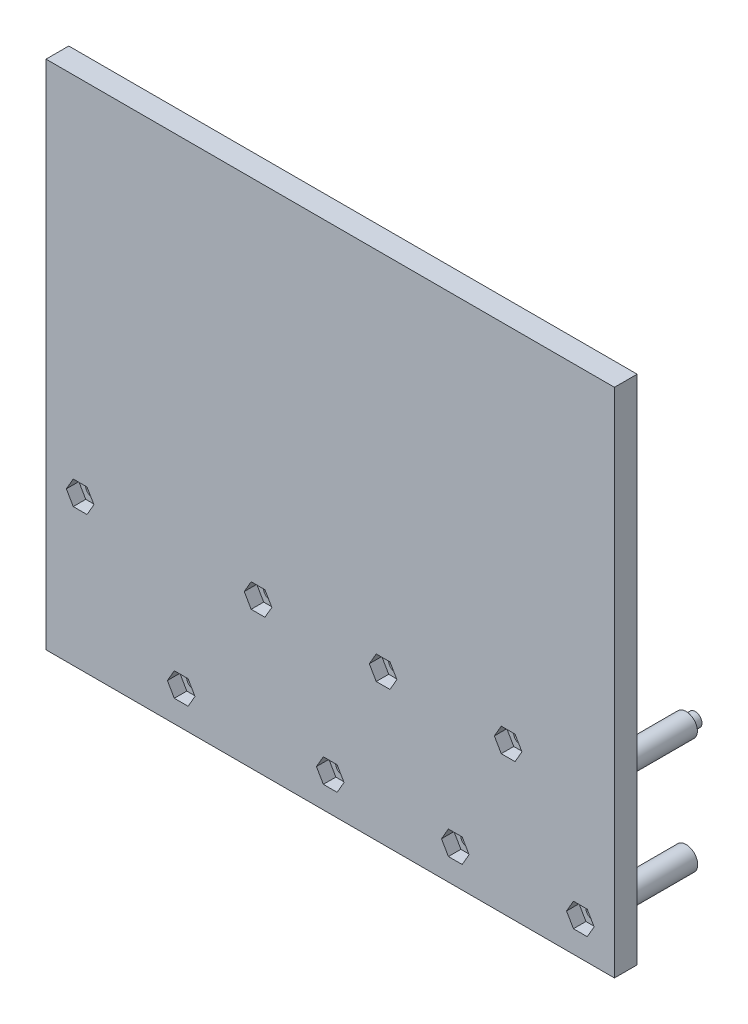
from build123d import *

# Parameters (mm, degrees)
SKETCH1_W           = 100
SKETCH1_H           = 90
BOSS_EXTRUDE1_DEPTH = 2
SKETCH2_R           = 2.05
SKETCH2_R_2         = 2
BOSS_EXTRUDE3_DEPTH = 18.6
SKETCH2_5_R         = 1.25
CUT_EXTRUDE1_DEPTH  = 70.792263182
SKETCH2_6_R         = 1.2
BOSS_EXTRUDE4_DEPTH = 20.2
CUT_EXTRUDE2_DEPTH  = 2.2
LPATTERN1_COUNT     = 3
LPATTERN1_PITCH     = 22
SKETCH4_R           = 2
SKETCH4_R_2         = 2.05
BOSS_EXTRUDE5_DEPTH = 18.6
SKETCH4_3_R         = 1.25
CUT_EXTRUDE3_DEPTH  = 71.235603507
SKETCH4_4_R         = 1.2
BOSS_EXTRUDE6_DEPTH = 20.2
CUT_EXTRUDE4_DEPTH  = 2.2


with BuildPart() as part:
    # Sketch1 → Boss-Extrude1 (new, symmetric)
    with BuildSketch(Plane.XY):
        Rectangle(SKETCH1_W, SKETCH1_H)
    extrude(amount=BOSS_EXTRUDE1_DEPTH, both=True)

    # Sketch2 → Boss-Extrude3 (add)
    with BuildSketch(Plane.XY.offset(2)):
        with Locations((31.3, -18.68)):
            Circle(SKETCH2_R)
        with Locations((44, -18.68)):
            Circle(SKETCH2_R_2)
        with Locations((31.3, -39)):
            Circle(SKETCH2_R_2)
        with Locations((44, -39)):
            Circle(SKETCH2_R)
    boss_extrude3 = extrude(amount=-BOSS_EXTRUDE3_DEPTH)

    # Sketch2<5> → Cut-Extrude1 (cut, through all)
    with BuildSketch(Plane.XY.offset(2)):
        with Locations((44, -39)):
            Circle(SKETCH2_5_R)
        with Locations((31.3, -18.68)):
            Circle(SKETCH2_5_R)
    cut_extrude1 = extrude(amount=-CUT_EXTRUDE1_DEPTH, mode=Mode.SUBTRACT)

    # Sketch2<6> → Boss-Extrude4 (add)
    with BuildSketch(Plane.XY.offset(2)):
        with Locations((44, -18.68)):
            Circle(SKETCH2_6_R)
        with Locations((31.3, -39)):
            Circle(SKETCH2_6_R)
    boss_extrude4 = extrude(amount=-BOSS_EXTRUDE4_DEPTH)

    # Sketch3 → Cut-Extrude2 (cut)
    with BuildSketch(Plane.XY.offset(2)):
        Polygon((30.087564435, -16.58), (28.875128869, -18.68), (30.087564435, -20.78), (32.512435565, -20.78), (33.724871131, -18.68), (32.512435565, -16.58), align=None)
        Polygon((42.787564435, -36.9), (41.575128869, -39), (42.787564435, -41.1), (45.212435565, -41.1), (46.424871131, -39), (45.212435565, -36.9), align=None)
    cut_extrude2 = extrude(amount=-CUT_EXTRUDE2_DEPTH, mode=Mode.SUBTRACT)

    # LPattern1: Boss-Extrude3, Cut-Extrude1, Boss-Extrude4, Cut-Extrude2 ×3
    with Locations(*[(-i * LPATTERN1_PITCH, 0, 0) for i in range(1, LPATTERN1_COUNT)]):
        add(boss_extrude3)
        add(cut_extrude1, mode=Mode.SUBTRACT)
        add(boss_extrude4)
        add(cut_extrude2, mode=Mode.SUBTRACT)

    # Sketch4 → Boss-Extrude5 (add)
    with BuildSketch(Plane.XY.offset(2)):
        with Locations((-44, -39)):
            Circle(SKETCH4_R)
        with Locations((-26.22, -39)):
            Circle(SKETCH4_R_2)
        with Locations((-44, -18.68)):
            Circle(SKETCH4_R_2)
        with Locations((-26.22, -18.68)):
            Circle(SKETCH4_R)
    extrude(amount=-BOSS_EXTRUDE5_DEPTH)

    # Sketch4<3> → Cut-Extrude3 (cut, through all)
    with BuildSketch(Plane.XY.offset(2)):
        with Locations((-26.22, -39)):
            Circle(SKETCH4_3_R)
        with Locations((-44, -18.68)):
            Circle(SKETCH4_3_R)
    extrude(amount=-CUT_EXTRUDE3_DEPTH, mode=Mode.SUBTRACT)

    # Sketch4<4> → Boss-Extrude6 (add)
    with BuildSketch(Plane.XY.offset(2)):
        with Locations((-44, -39)):
            Circle(SKETCH4_4_R)
        with Locations((-26.22, -18.68)):
            Circle(SKETCH4_4_R)
    extrude(amount=-BOSS_EXTRUDE6_DEPTH)

    # Sketch5 → Cut-Extrude4 (cut)
    with BuildSketch(Plane.XY.offset(2)):
        Polygon((-45.212435565, -16.58), (-46.424871131, -18.68), (-45.212435565, -20.78), (-42.787564435, -20.78), (-41.575128869, -18.68), (-42.787564435, -16.58), align=None)
        Polygon((-27.432435565, -36.9), (-28.644871131, -39), (-27.432435565, -41.1), (-25.007564435, -41.1), (-23.795128869, -39), (-25.007564435, -36.9), align=None)
    extrude(amount=-CUT_EXTRUDE4_DEPTH, mode=Mode.SUBTRACT)


solid = part.part
